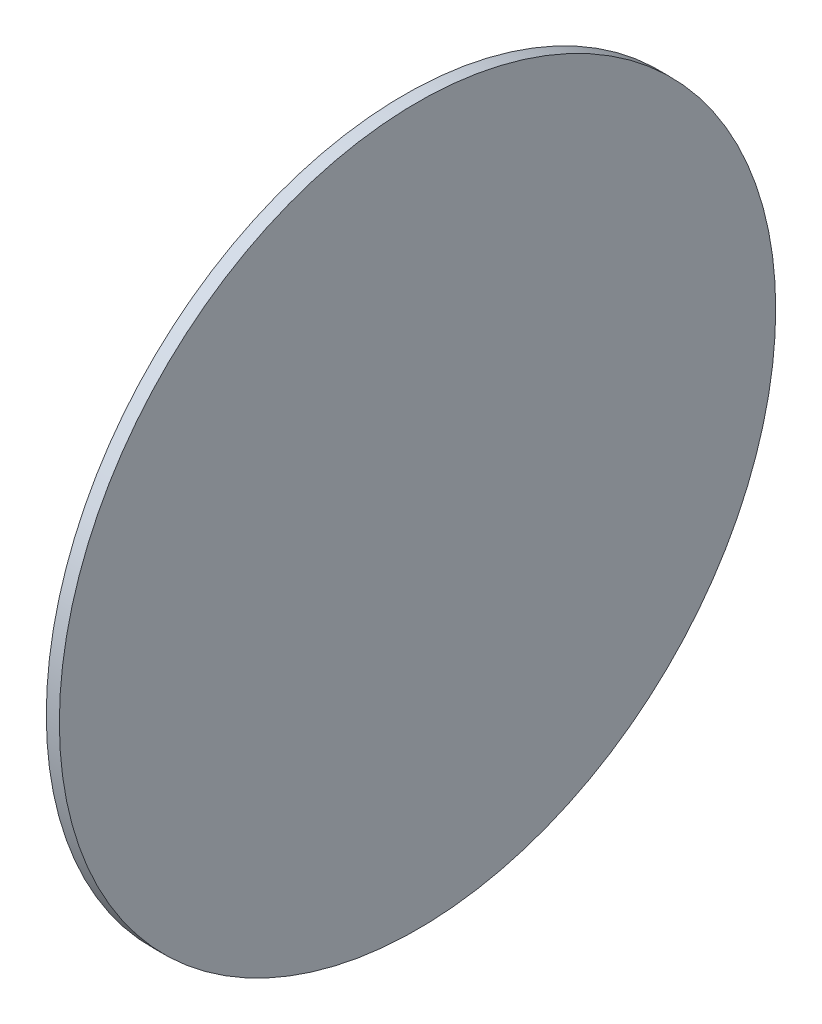
from build123d import *

# Parameters (mm, degrees)
SKETCH1_R           = 130.175
BOSS_EXTRUDE1_DEPTH = 4.75


with BuildPart() as part:
    # Sketch1 → Boss-Extrude1 (new body)
    with BuildSketch(Plane(origin=(0, 0, 0), x_dir=(0, 0, -1), z_dir=(1, 0, 0))):
        Circle(SKETCH1_R)
    extrude(amount=BOSS_EXTRUDE1_DEPTH)


solid = part.part
